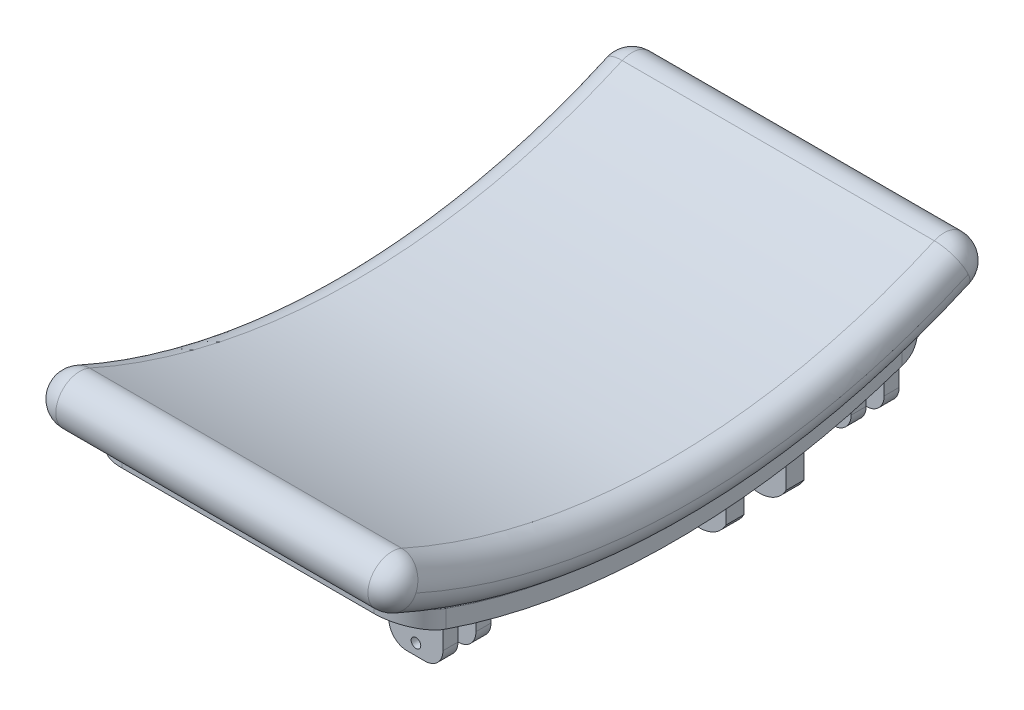
from build123d import *

# Parameters (mm, degrees)
BOSS_EXTRUDE1_DEPTH      = 150
FILLET1_R                = 20
BOSS_EXTRUDE2_DEPTH      = 135
FILLET2_R                = 30
BOSS_EXTRUDE3_REACH      = 311.991
BOSS_EXTRUDE3_END_RADIUS = 585.4328222674012
SKETCH5_W                = 44.99999999999996
SKETCH5_H                = 15.000000000000028
CUT_EXTRUDE1_DEPTH       = 30
FILLET3_R                = 15
SKETCH6_R                = 4.000000000000007
CUT_EXTRUDE2_DEPTH       = 44.000000000000014
BOSS_EXTRUDE4_REACH      = 327.762
BOSS_EXTRUDE4_END_RADIUS = 585.4328222674012
SKETCH7_W                = 64.99999999999997
SKETCH7_H                = 14.999999999999993
SKETCH7_H_2              = 15
FILLET4_R                = 1
CUT_EXTRUDE5_REACH       = 667.649
SKETCH9_R                = 3.0000000000000084


with BuildPart() as part:
    # Sketch1 → Boss-Extrude1 (new, symmetric)
    with BuildSketch(Plane(origin=(0, 0, 0), x_dir=(0, 0, -1), z_dir=(1, 0, 0))):
        with BuildLine():
            ThreePointArc((-238.1705150976909, -422.9251079306098), (3.57e-14, -473.79372778271767), (238.1705150976909, -422.9251079306098))
            ThreePointArc((238.1705150976909, -422.9251079306098), (248.25493585412997, -396.499656978789), (221.82948490230902, -386.4152362223495))
            ThreePointArc((221.82948490230902, -386.4152362223495), (3.325e-14, -433.79372778271744), (-221.82948490230902, -386.4152362223495))
            ThreePointArc((-221.82948490230902, -386.4152362223495), (-248.2549358541303, -396.49965697878883), (-238.1705150976909, -422.9251079306098))
        make_face()
    extrude(amount=BOSS_EXTRUDE1_DEPTH, both=True)

    # Fillet1
    fillet1_edges = [part.edges().sort_by_distance(p)[0] for p in [
        (150, -396.49965697878883, -248.25493585412988),
        (150, -433.79372778271744, -7.11e-15),
        (150, -396.49965697878866, 248.25493585413022),
        (-150, -433.79372778271744, -7.11e-15),
        (-150, -396.49965697878883, -248.25493585412988),
        (-150, -473.7937277827177, 2.842e-14),
        (-150, -396.49965697878866, 248.25493585413022),
        (150, -473.7937277827177, 2.842e-14),
    ]]
    fillet(fillet1_edges, radius=FILLET1_R)


with BuildPart() as body_2:
    # Sketch2 → Boss-Extrude2 (new, symmetric)
    with BuildSketch(Plane(origin=(0, 0, 0), x_dir=(0, 0, -1), z_dir=(1, 0, 0))):
        with BuildLine():
            Line((-220, -430.6909402222708), (-220, -446.91247495884767))
            ThreePointArc((-220, -446.91247495884767), (8.09e-15, -489.8219434542895), (220, -446.91247495884767))
            Line((220, -446.91247495884767), (220, -430.6909402222708))
            ThreePointArc((220, -430.6909402222708), (7.17e-15, -474.8219434542895), (-220, -430.6909402222708))
        make_face()
    extrude(amount=BOSS_EXTRUDE2_DEPTH, both=True)

    # Fillet2
    fillet2_edges = [body_2.edges().sort_by_distance(p)[0] for p in [
        (135, -438.8017075905592, -220),
        (-135, -438.8017075905592, -220),
        (-135, -438.8017075905592, 220),
        (135, -438.8017075905592, 220),
    ]]
    fillet(fillet2_edges, radius=FILLET2_R)

    # Boss-Extrude3: up to this cylinder (the profile starts outside it)
    boss_extrude3_end = Plane(origin=(110, 95.6108788131117, 2.776e-14), z_dir=(-1, 0, 0)) * Cylinder(BOSS_EXTRUDE3_END_RADIUS, 1795.8476445348024, mode=Mode.PRIVATE)
    # Sketch3 → Boss-Extrude3 (add, up to the surface)
    with BuildSketch(Plane(origin=(0, -490, 0), x_dir=(1, 0, 0), z_dir=(0, 1, 0)), mode=Mode.PRIVATE) as boss_extrude3_sk1:
        Polygon((87.50000000000001, -190.00000000000003), (132.5, -190.00000000000003), (132.5, -150.00000000000003), (87.5, -150.00000000000003), align=None)
    boss_extrude3_tool1 = extrude(boss_extrude3_sk1.sketch, amount=BOSS_EXTRUDE3_REACH, mode=Mode.PRIVATE) - boss_extrude3_end
    add(boss_extrude3_tool1.solids().sort_by_distance((110, -490, 170))[0])
    # Sketch3 → Boss-Extrude3 (add, up to the surface)
    with BuildSketch(Plane(origin=(0, -490, 0), x_dir=(1, 0, 0), z_dir=(0, 1, 0)), mode=Mode.PRIVATE) as boss_extrude3_sk2:
        Polygon((87.50000000000007, 150), (132.50000000000006, 150), (132.50000000000003, 190), (87.50000000000007, 190), align=None)
    boss_extrude3_tool2 = extrude(boss_extrude3_sk2.sketch, amount=BOSS_EXTRUDE3_REACH, mode=Mode.PRIVATE) - boss_extrude3_end
    add(boss_extrude3_tool2.solids().sort_by_distance((110, -490, -170))[0])

    # Sketch5 → Cut-Extrude1 (cut)
    with BuildSketch(Plane.XZ.offset(490)):
        with Locations((110.00000000000006, -170)):
            Rectangle(SKETCH5_W, SKETCH5_H)
    cut_extrude1 = extrude(amount=-CUT_EXTRUDE1_DEPTH, mode=Mode.SUBTRACT)

    # Mirror1: Cut-Extrude1 across plane
    add(cut_extrude1.mirror(Plane.XY), mode=Mode.SUBTRACT)

    # Fillet3
    fillet3_edges = [body_2.edges().sort_by_distance(p)[0] for p in [
        (132.5, -490, 183.75),
        (87.5, -490, 156.25),
        (132.50000000000006, -490, -156.25),
        (87.50000000000007, -490, -183.75),
        (132.50000000000003, -490, -183.75),
        (87.50000000000007, -490, -156.25),
        (132.5, -490, 156.25),
        (87.50000000000001, -490, 183.75),
    ]]
    fillet(fillet3_edges, radius=FILLET3_R)

    # Sketch6 → Cut-Extrude2 (cut)
    with BuildSketch(Plane.XY.offset(190.00000000000003)):
        with Locations((110.00000000000007, -480.63237341482693)):
            Circle(SKETCH6_R)
    cut_extrude2 = extrude(amount=-CUT_EXTRUDE2_DEPTH, mode=Mode.SUBTRACT)

    # Mirror2: Cut-Extrude2 across plane
    add(cut_extrude2.mirror(Plane.XY), mode=Mode.SUBTRACT)

    # Boss-Extrude4: up to this cylinder (the profile starts outside it)
    boss_extrude4_end = Plane(origin=(86.959805, 95.6108788131117, 2.776e-14), z_dir=(-1, 0, 0)) * Cylinder(BOSS_EXTRUDE4_END_RADIUS, 1827.3896445348023, mode=Mode.PRIVATE)
    # Sketch7 → Boss-Extrude4 (add, up to the surface)
    with BuildSketch(Plane(origin=(0, -530, 0), x_dir=(1, 0, 0), z_dir=(0, 1, 0)), mode=Mode.PRIVATE) as boss_extrude4_sk1:
        with Locations((86.95980527462508, 66.25)):
            Rectangle(SKETCH7_W, SKETCH7_H)
    boss_extrude4_tool1 = extrude(boss_extrude4_sk1.sketch, amount=BOSS_EXTRUDE4_REACH, mode=Mode.PRIVATE) - boss_extrude4_end
    add(boss_extrude4_tool1.solids().sort_by_distance((86.959805, -530, -66.25))[0])
    # Sketch7 → Boss-Extrude4 (add, up to the surface)
    with BuildSketch(Plane(origin=(0, -530, 0), x_dir=(1, 0, 0), z_dir=(0, 1, 0)), mode=Mode.PRIVATE) as boss_extrude4_sk2:
        with Locations((86.95980527462508, 116.25000000000001)):
            Rectangle(SKETCH7_W, SKETCH7_H_2)
    boss_extrude4_tool2 = extrude(boss_extrude4_sk2.sketch, amount=BOSS_EXTRUDE4_REACH, mode=Mode.PRIVATE) - boss_extrude4_end
    add(boss_extrude4_tool2.solids().sort_by_distance((86.959805, -530, -116.25))[0])

    # Fillet4
    fillet4_edges = [body_2.edges().sort_by_distance(p)[0] for p in [
        (135, -474.8219434542895, -7.816e-14),
        (-135, -474.8219434542895, -7.816e-14),
        (0, -430.6909402222708, 220),
        (0, -430.6909402222708, -220),
        (126.53973703485076, -434.41041372392294, 210.8815643394535),
        (-126.53973703485073, -434.41041372392294, 210.8815643394535),
        (-126.53973702160343, -434.4104137312719, -210.88156432776083),
        (126.5397370216034, -434.41041373127194, -210.88156432776083),
    ]]
    fillet(fillet4_edges, radius=FILLET4_R)

    # Cut-Extrude5: up to this face of the body (flat: up to its plane)
    cut_extrude5_end = Plane(body_2.part.faces().sort_by_distance((86.959805275, -508.433305821, -58.75))[0])
    # Sketch9 → Cut-Extrude5 (cut, up to the picked face)
    with BuildSketch(Plane(origin=(0, 0, -123.75000000000001), x_dir=(-1, 0, 0), z_dir=(0, 0, -1)), mode=Mode.PRIVATE) as cut_extrude5_sk1:
        with Locations((-97.47760480541997, -503.2609520653121)):
            Circle(SKETCH9_R)
    cut_extrude5_tool1 = split(extrude(cut_extrude5_sk1.sketch, amount=-CUT_EXTRUDE5_REACH, mode=Mode.PRIVATE), bisect_by=cut_extrude5_end, keep=Keep.BOTH, mode=Mode.PRIVATE)
    # Sketch9 → Cut-Extrude5 (cut, up to the picked face)
    with BuildSketch(Plane(origin=(0, 0, -123.75000000000001), x_dir=(-1, 0, 0), z_dir=(0, 0, -1)), mode=Mode.PRIVATE) as cut_extrude5_sk2:
        with BuildLine():
            Line((-54.45980527462509, -476.59321667028706), (-75.49540433621485, -515.2292736670768))
            ThreePointArc((-75.49540433621485, -515.2292736670768), (-97.47760480541997, -528.2900922709123), (-119.45980527462508, -515.2292736670768))
            Line((-119.45980527462508, -515.2292736670768), (-119.45980527462508, -530))
            Line((-119.45980527462508, -530), (-54.45980527462509, -530))
            Line((-54.45980527462509, -530), (-54.45980527462509, -476.59321667028706))
        make_face()
    cut_extrude5_tool2 = split(extrude(cut_extrude5_sk2.sketch, amount=-CUT_EXTRUDE5_REACH, mode=Mode.PRIVATE), bisect_by=cut_extrude5_end, keep=Keep.BOTH, mode=Mode.PRIVATE)
    add(cut_extrude5_tool1.solids().sort_by(Axis((97.477605, -503.260952, -123.75), (0, 0, 1)))[0], mode=Mode.SUBTRACT)
    add(cut_extrude5_tool2.solids().sort_by(Axis((71.659746, -514.88072, -123.75), (0, 0, 1)))[0], mode=Mode.SUBTRACT)


solid = Compound([part.part, body_2.part])
